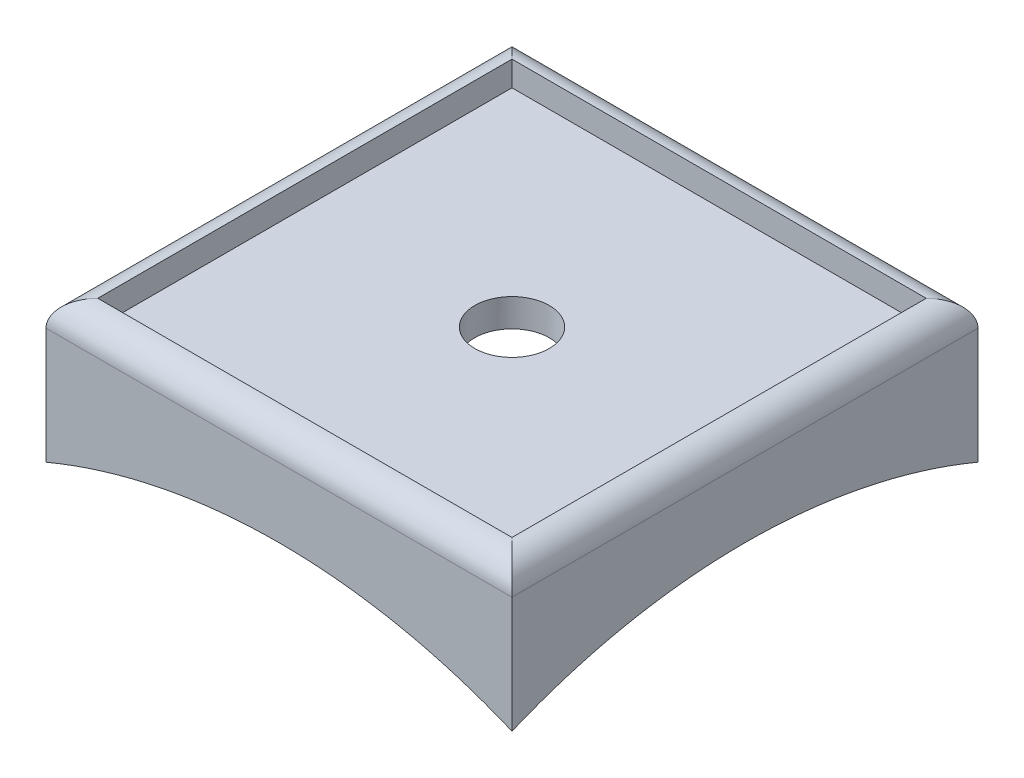
from build123d import *

# Parameters (mm, degrees)
SKETCH_1_W          = 54
SKETCH_1_H          = 54
EXTRUDE_1_DEPTH     = 27
SKETCH_2_W          = 54
SKETCH_2_H          = 54
SKETCH_2_W_2        = 18
SKETCH_2_H_2        = 18
CUT_EXTRUDE_1_DEPTH = 54
SKETCH_3_W          = 18
SKETCH_3_H          = 36
CUT_EXTRUDE_2_DEPTH = 34.674916481
FILLET_1_R          = 1
SCALE_1_SCALE       = 2.083333333
SKETCH_5_W          = 33.333333334
SKETCH_5_H          = 33.333333334
CUT_EXTRUDE_3_DEPTH = 2
SKETCH_6_R          = 3
CUT_EXTRUDE_4_DEPTH = 6


with BuildPart() as part:
    # 草图1 → 凸台-拉伸1 (new, symmetric)
    with BuildSketch(Plane.XY):
        Rectangle(SKETCH_1_W, SKETCH_1_H)
    extrude(amount=EXTRUDE_1_DEPTH, both=True)

    # 草图2 → 切除-拉伸1 (cut)
    with BuildSketch(Plane(origin=(0, 27, 0), x_dir=(1, 0, 0), z_dir=(0, 1, 0))):
        Rectangle(SKETCH_2_W, SKETCH_2_H)
        Rectangle(SKETCH_2_W_2, SKETCH_2_H_2, mode=Mode.SUBTRACT)
    extrude(amount=-CUT_EXTRUDE_1_DEPTH, mode=Mode.SUBTRACT)

    # 草图3 → 切除-拉伸2 (cut, through all)
    with BuildSketch(Plane.XY.offset(9)):
        with Locations((0, -9)):
            Rectangle(SKETCH_3_W, SKETCH_3_H)
    extrude(amount=-CUT_EXTRUDE_2_DEPTH, mode=Mode.SUBTRACT)

    # 草图4 → 切除-旋转1 (revolve, cut)
    with BuildSketch(Plane.XY):
        with BuildLine():
            Line((0, 25), (0, -25))
            ThreePointArc((0, -25), (-25, 0), (0, 25))
        make_face()
    revolve(axis=Axis((0, 25, 0), (0, -1, 0)), mode=Mode.SUBTRACT)

    # 圆角1
    fillet_1_edges = [part.edges().sort_by_distance(p)[0] for p in [
        (9, 27, 0),
        (0, 27, 9),
        (-9, 27, 0),
        (0, 27, -9),
    ]]
    fillet(fillet_1_edges, radius=FILLET_1_R)


with BuildPart() as part_1:
    # 缩放比例1: scaled about (0, 0, 0)
    add(part.part.scale(SCALE_1_SCALE))

    # 草图5 → 切除-拉伸3 (cut)
    with BuildSketch(Plane(origin=(0, 56.25, 0), x_dir=(1, 0, 0), z_dir=(0, 1, 0))):
        Rectangle(SKETCH_5_W, SKETCH_5_H)
    extrude(amount=-CUT_EXTRUDE_3_DEPTH, mode=Mode.SUBTRACT)

    # 草图6 → 切除-拉伸4 (cut)
    with BuildSketch(Plane(origin=(0, 54.25, 0), x_dir=(1, 0, 0), z_dir=(0, 1, 0))):
        with Locations(Location((0, 0, 0), (0, 0, 270))):
            Circle(SKETCH_6_R)
    extrude(amount=-CUT_EXTRUDE_4_DEPTH, mode=Mode.SUBTRACT)


solid = part_1.part
